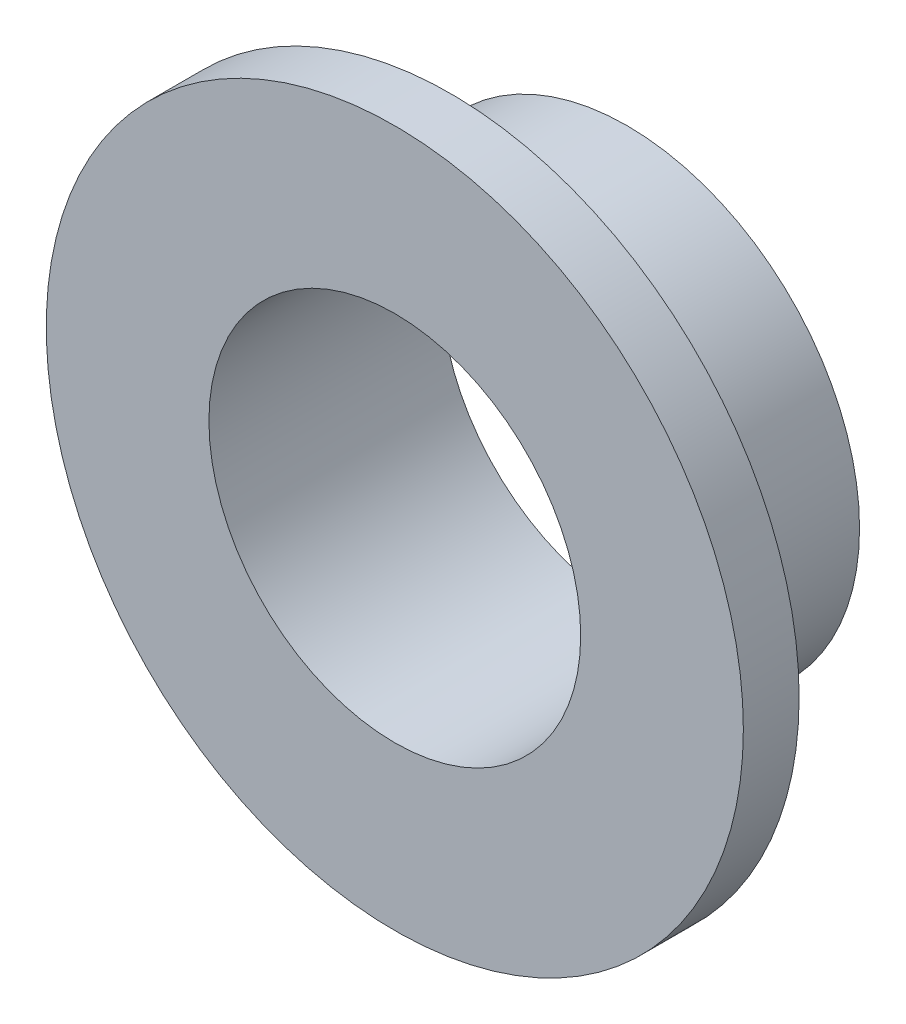
from build123d import *


with BuildPart() as part:
    # Sketch1 → Revolve1 (revolve)
    with BuildSketch(Plane(origin=(0, 0, 0), x_dir=(0, 0, -1), z_dir=(1, 0, 0)), mode=Mode.PRIVATE) as revolve1_sk:
        Polygon((0, 4), (0, 7.5), (1.2, 7.5), (1.2, 5), (5, 5), (5, 4), align=None)
    revolve(revolve1_sk.sketch.rotate(Axis((0, 0, 0), (0, 0, -1)), 90), axis=Axis((0, 0, 0), (0, 0, -1)))


solid = part.part
